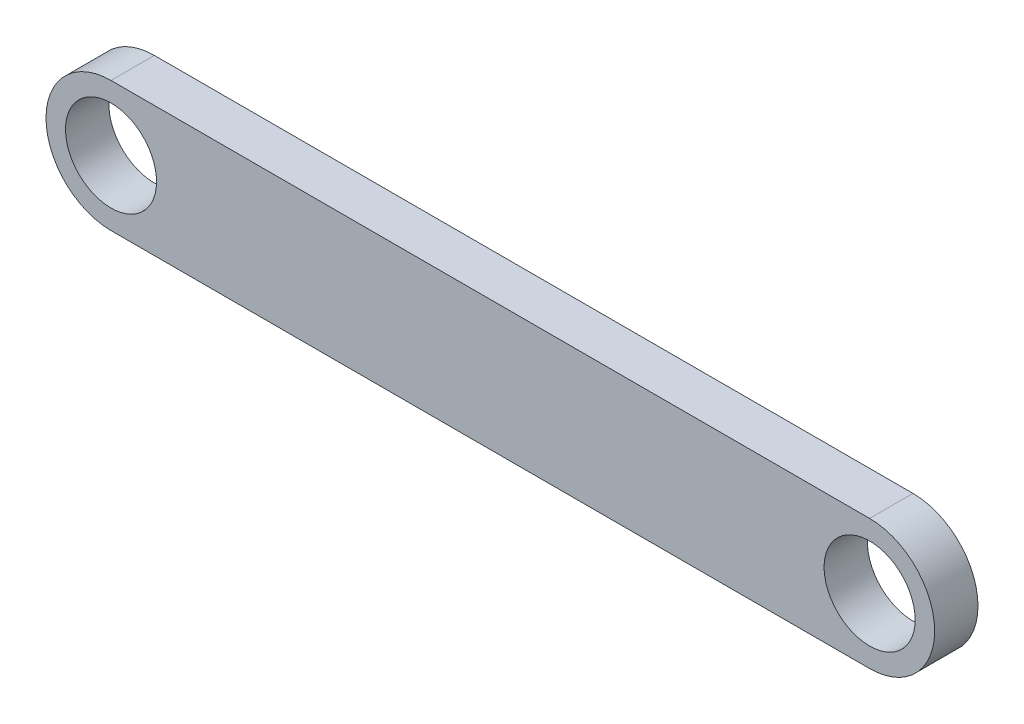
from build123d import *

# Parameters (mm, degrees)
SKETCH_1_R      = 4.2
EXTRUDE_1_DEPTH = 4


with BuildPart() as part:
    # 草图1 → 凸台-拉伸1 (new body)
    with BuildSketch(Plane(origin=(0, 0, 0), x_dir=(-1, 0, 0), z_dir=(0, 0, -1))):
        with BuildLine():
            Line((20, 6), (-50, 6))
            ThreePointArc((-50, 6), (-56, 0), (-50, -6))
            Line((-50, -6), (20, -6))
            ThreePointArc((20, -6), (26, 0), (20, 6))
        make_face()
        with Locations(Location((20, 0, 0), (0, 0, 180))):
            Circle(SKETCH_1_R, mode=Mode.SUBTRACT)
        with Locations(Location((-50, 0, 0), (0, 0, 180))):
            Circle(SKETCH_1_R, mode=Mode.SUBTRACT)
    extrude(amount=-EXTRUDE_1_DEPTH)


solid = part.part
